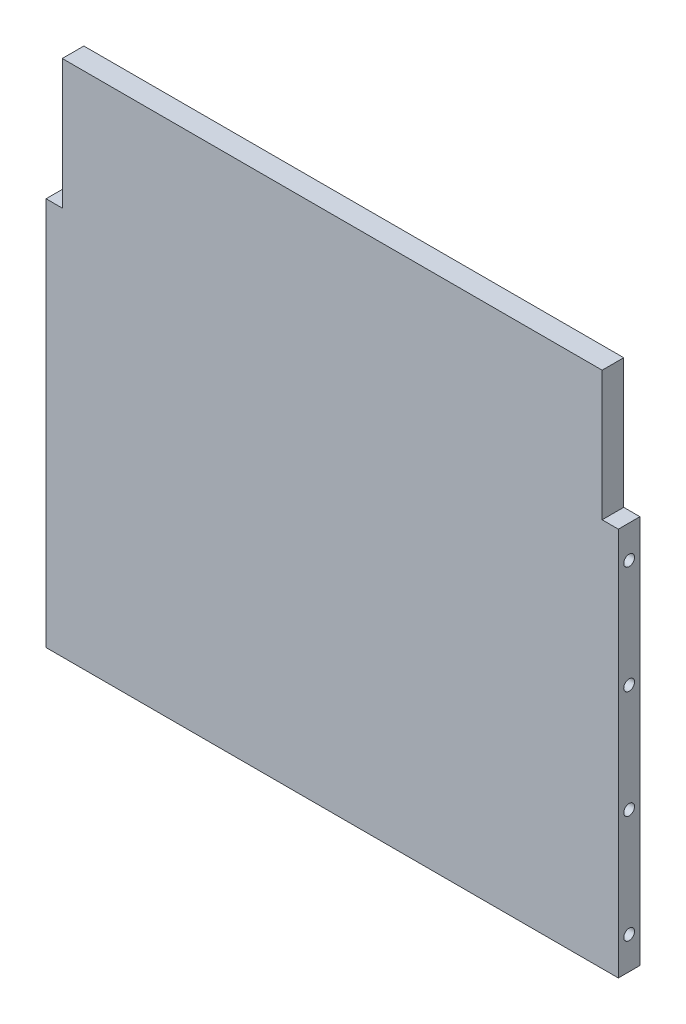
from build123d import *

# Parameters (mm, degrees)
BOSS_EXTRUDE1_DEPTH = 20
SKETCH3_R           = 5
CUT_EXTRUDE1_DEPTH  = 30
CUT_EXTRUDE2_START  = -30
SKETCH4_R           = 5
CUT_EXTRUDE2_DEPTH  = 30


with BuildPart() as part:
    # Sketch1 → Boss-Extrude1 (new body)
    with BuildSketch(Plane.XY):
        Polygon((-250, 240), (250, 240), (250, 120), (265, 120), (265, -240), (-265, -240), (-265, 120), (-250, 120), align=None)
    extrude(amount=BOSS_EXTRUDE1_DEPTH)

    # Sketch3 → Cut-Extrude1 (cut)
    with BuildSketch(Plane(origin=(265, 0, 0), x_dir=(0, 0, -1), z_dir=(1, 0, 0))):
        with Locations(Location((-10, -210, 0), (0, 0, 90))):
            Circle(SKETCH3_R)
        with Locations(Location((-10, -110, 0), (0, 0, 90))):
            Circle(SKETCH3_R)
        with Locations(Location((-10, -10, 0), (0, 0, 90))):
            Circle(SKETCH3_R)
        with Locations(Location((-10, 90, 0), (0, 0, 90))):
            Circle(SKETCH3_R)
    extrude(amount=-CUT_EXTRUDE1_DEPTH, mode=Mode.SUBTRACT)

    # Sketch4 → Cut-Extrude2 (cut)
    with BuildSketch(Plane.ZY.offset(265).offset(CUT_EXTRUDE2_START)):
        with Locations(Location((10, -210, 0), (0, 0, 90))):
            Circle(SKETCH4_R)
        with Locations(Location((10, -110, 0), (0, 0, 90))):
            Circle(SKETCH4_R)
        with Locations(Location((10, -10, 0), (0, 0, 90))):
            Circle(SKETCH4_R)
        with Locations(Location((10, 90, 0), (0, 0, 90))):
            Circle(SKETCH4_R)
    extrude(amount=CUT_EXTRUDE2_DEPTH, mode=Mode.SUBTRACT)


solid = part.part
